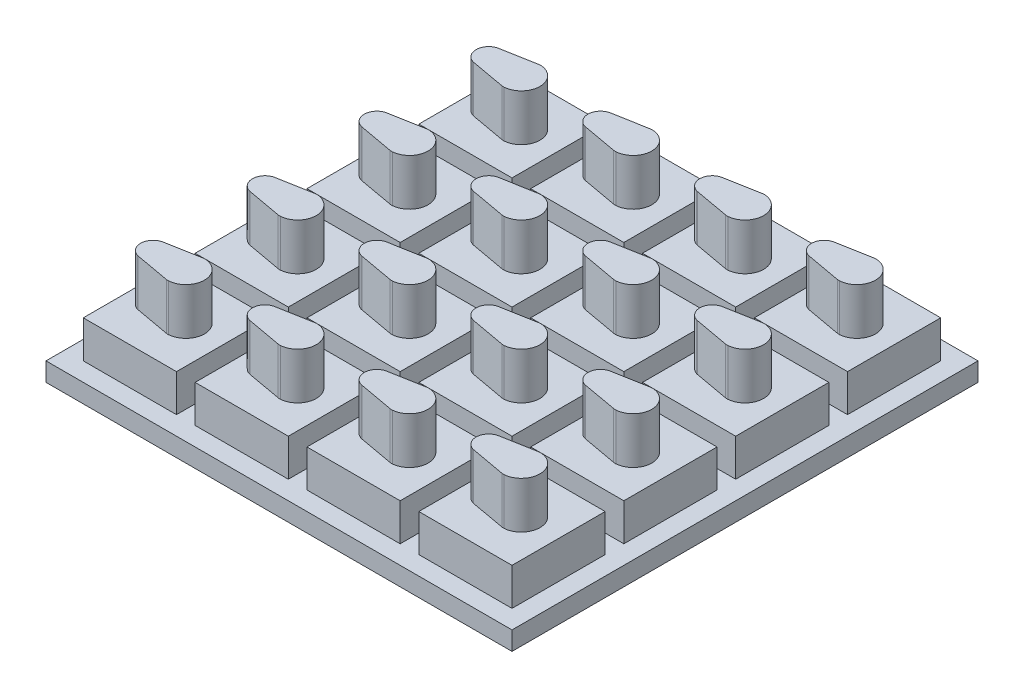
from build123d import *

# Parameters (mm, degrees)
BOSS_EXTRUDE10_DEPTH    = 11
BOSS_EXTRUDE10_2_DEPTH  = 11
BOSS_EXTRUDE10_3_DEPTH  = 11
BOSS_EXTRUDE10_4_DEPTH  = 11
BOSS_EXTRUDE10_5_DEPTH  = 11
BOSS_EXTRUDE10_6_DEPTH  = 11
BOSS_EXTRUDE10_7_DEPTH  = 11
BOSS_EXTRUDE10_8_DEPTH  = 11
BOSS_EXTRUDE10_9_DEPTH  = 11
BOSS_EXTRUDE10_10_DEPTH = 11
BOSS_EXTRUDE10_11_DEPTH = 11
BOSS_EXTRUDE10_12_DEPTH = 11
BOSS_EXTRUDE10_13_DEPTH = 11
BOSS_EXTRUDE10_14_DEPTH = 11
BOSS_EXTRUDE10_15_DEPTH = 11
BOSS_EXTRUDE10_16_DEPTH = 11
SKETCH1_21_W            = 10
SKETCH1_21_H            = 10
BOSS_EXTRUDE11_DEPTH    = 6
SKETCH1_22_W            = 10
SKETCH1_22_H            = 10
BOSS_EXTRUDE12_DEPTH    = 2


with BuildPart() as part:
    # Sketch1 → Boss-Extrude10 (new body)
    with BuildSketch(Plane(origin=(0, 0, 0), x_dir=(1, 0, 0), z_dir=(0, 1, 0))):
        with BuildLine():
            Line((-0.103477426, 1.981305986), (-3.791774707, 1.314985976))
            ThreePointArc((-3.791774707, 1.314985976), (-3.866472803, 1.298518324), (-3.939693652, 1.27638924))
            ThreePointArc((-3.939693652, 1.27638924), (-4.85, 0), (-3.939693652, -1.27638924))
            ThreePointArc((-3.939693652, -1.27638924), (-3.866472803, -1.298518324), (-3.791774707, -1.314985976))
            Line((-3.791774707, -1.314985976), (-0.103477426, -1.981305986))
            ThreePointArc((-0.103477426, -1.981305986), (0.022146835, -1.995874699), (0.14860526, -1.994471478))
            ThreePointArc((0.14860526, -1.994471478), (2, 0), (0.14860526, 1.994471478))
            ThreePointArc((0.14860526, 1.994471478), (0.022146835, 1.995874699), (-0.103477426, 1.981305986))
        make_face()
    extrude(amount=BOSS_EXTRUDE10_DEPTH)



with BuildPart() as body_2:
    # Sketch1 → Boss-Extrude10 2 (new body)
    with BuildSketch(Plane(origin=(0, 0, 0), x_dir=(1, 0, 0), z_dir=(0, 1, 0))):
        with BuildLine():
            Line((-12.103477426, 1.981305986), (-15.791774707, 1.314985976))
            ThreePointArc((-15.791774707, 1.314985976), (-15.866472803, 1.298518324), (-15.939693652, 1.27638924))
            ThreePointArc((-15.939693652, 1.27638924), (-16.85, 0), (-15.939693652, -1.27638924))
            ThreePointArc((-15.939693652, -1.27638924), (-15.866472803, -1.298518324), (-15.791774707, -1.314985976))
            Line((-15.791774707, -1.314985976), (-12.103477426, -1.981305986))
            ThreePointArc((-12.103477426, -1.981305986), (-11.977853165, -1.995874699), (-11.85139474, -1.994471478))
            ThreePointArc((-11.85139474, -1.994471478), (-10, 0), (-11.85139474, 1.994471478))
            ThreePointArc((-11.85139474, 1.994471478), (-11.977853165, 1.995874699), (-12.103477426, 1.981305986))
        make_face()
    extrude(amount=BOSS_EXTRUDE10_2_DEPTH)


with BuildPart() as body_3:
    # Sketch1 → Boss-Extrude10 3 (new body)
    with BuildSketch(Plane(origin=(0, 0, 0), x_dir=(1, 0, 0), z_dir=(0, 1, 0))):
        with BuildLine():
            Line((-24.103477426, 1.981305986), (-27.791774707, 1.314985976))
            ThreePointArc((-27.791774707, 1.314985976), (-27.866472803, 1.298518324), (-27.939693652, 1.27638924))
            ThreePointArc((-27.939693652, 1.27638924), (-28.85, 0), (-27.939693652, -1.27638924))
            ThreePointArc((-27.939693652, -1.27638924), (-27.866472803, -1.298518324), (-27.791774707, -1.314985976))
            Line((-27.791774707, -1.314985976), (-24.103477426, -1.981305986))
            ThreePointArc((-24.103477426, -1.981305986), (-23.977853165, -1.995874699), (-23.85139474, -1.994471478))
            ThreePointArc((-23.85139474, -1.994471478), (-22, 0), (-23.85139474, 1.994471478))
            ThreePointArc((-23.85139474, 1.994471478), (-23.977853165, 1.995874699), (-24.103477426, 1.981305986))
        make_face()
    extrude(amount=BOSS_EXTRUDE10_3_DEPTH)


with BuildPart() as body_4:
    # Sketch1 → Boss-Extrude10 4 (new body)
    with BuildSketch(Plane(origin=(0, 0, 0), x_dir=(1, 0, 0), z_dir=(0, 1, 0))):
        with BuildLine():
            Line((-0.103477426, 13.981305986), (-3.791774707, 13.314985976))
            ThreePointArc((-3.791774707, 13.314985976), (-3.866472803, 13.298518324), (-3.939693652, 13.27638924))
            ThreePointArc((-3.939693652, 13.27638924), (-4.85, 12), (-3.939693652, 10.72361076))
            ThreePointArc((-3.939693652, 10.72361076), (-3.866472803, 10.701481676), (-3.791774707, 10.685014024))
            Line((-3.791774707, 10.685014024), (-0.103477426, 10.018694014))
            ThreePointArc((-0.103477426, 10.018694014), (0.022146835, 10.004125301), (0.14860526, 10.005528522))
            ThreePointArc((0.14860526, 10.005528522), (2, 12), (0.14860526, 13.994471478))
            ThreePointArc((0.14860526, 13.994471478), (0.022146835, 13.995874699), (-0.103477426, 13.981305986))
        make_face()
    extrude(amount=BOSS_EXTRUDE10_4_DEPTH)


with BuildPart() as body_5:
    # Sketch1 → Boss-Extrude10 5 (new body)
    with BuildSketch(Plane(origin=(0, 0, 0), x_dir=(1, 0, 0), z_dir=(0, 1, 0))):
        with BuildLine():
            Line((-12.103477426, 13.981305986), (-15.791774707, 13.314985976))
            ThreePointArc((-15.791774707, 13.314985976), (-15.866472803, 13.298518324), (-15.939693652, 13.27638924))
            ThreePointArc((-15.939693652, 13.27638924), (-16.85, 12), (-15.939693652, 10.72361076))
            ThreePointArc((-15.939693652, 10.72361076), (-15.866472803, 10.701481676), (-15.791774707, 10.685014024))
            Line((-15.791774707, 10.685014024), (-12.103477426, 10.018694014))
            ThreePointArc((-12.103477426, 10.018694014), (-11.977853165, 10.004125301), (-11.85139474, 10.005528522))
            ThreePointArc((-11.85139474, 10.005528522), (-10, 12), (-11.85139474, 13.994471478))
            ThreePointArc((-11.85139474, 13.994471478), (-11.977853165, 13.995874699), (-12.103477426, 13.981305986))
        make_face()
    extrude(amount=BOSS_EXTRUDE10_5_DEPTH)


with BuildPart() as body_6:
    # Sketch1 → Boss-Extrude10 6 (new body)
    with BuildSketch(Plane(origin=(0, 0, 0), x_dir=(1, 0, 0), z_dir=(0, 1, 0))):
        with BuildLine():
            Line((-24.103477426, 13.981305986), (-27.791774707, 13.314985976))
            ThreePointArc((-27.791774707, 13.314985976), (-27.866472803, 13.298518324), (-27.939693652, 13.27638924))
            ThreePointArc((-27.939693652, 13.27638924), (-28.85, 12), (-27.939693652, 10.72361076))
            ThreePointArc((-27.939693652, 10.72361076), (-27.866472803, 10.701481676), (-27.791774707, 10.685014024))
            Line((-27.791774707, 10.685014024), (-24.103477426, 10.018694014))
            ThreePointArc((-24.103477426, 10.018694014), (-23.977853165, 10.004125301), (-23.85139474, 10.005528522))
            ThreePointArc((-23.85139474, 10.005528522), (-22, 12), (-23.85139474, 13.994471478))
            ThreePointArc((-23.85139474, 13.994471478), (-23.977853165, 13.995874699), (-24.103477426, 13.981305986))
        make_face()
    extrude(amount=BOSS_EXTRUDE10_6_DEPTH)


with BuildPart() as body_7:
    # Sketch1 → Boss-Extrude10 7 (new body)
    with BuildSketch(Plane(origin=(0, 0, 0), x_dir=(1, 0, 0), z_dir=(0, 1, 0))):
        with BuildLine():
            Line((-12.103477426, -10.018694014), (-15.791774707, -10.685014024))
            ThreePointArc((-15.791774707, -10.685014024), (-15.866472803, -10.701481676), (-15.939693652, -10.72361076))
            ThreePointArc((-15.939693652, -10.72361076), (-16.85, -12), (-15.939693652, -13.27638924))
            ThreePointArc((-15.939693652, -13.27638924), (-15.866472803, -13.298518324), (-15.791774707, -13.314985976))
            Line((-15.791774707, -13.314985976), (-12.103477426, -13.981305986))
            ThreePointArc((-12.103477426, -13.981305986), (-11.977853165, -13.995874699), (-11.85139474, -13.994471478))
            ThreePointArc((-11.85139474, -13.994471478), (-10, -12), (-11.85139474, -10.005528522))
            ThreePointArc((-11.85139474, -10.005528522), (-11.977853165, -10.004125301), (-12.103477426, -10.018694014))
        make_face()
    extrude(amount=BOSS_EXTRUDE10_7_DEPTH)


with BuildPart() as body_8:
    # Sketch1 → Boss-Extrude10 8 (new body)
    with BuildSketch(Plane(origin=(0, 0, 0), x_dir=(1, 0, 0), z_dir=(0, 1, 0))):
        with BuildLine():
            Line((-0.103477426, -10.018694014), (-3.791774707, -10.685014024))
            ThreePointArc((-3.791774707, -10.685014024), (-3.866472803, -10.701481676), (-3.939693652, -10.72361076))
            ThreePointArc((-3.939693652, -10.72361076), (-4.85, -12), (-3.939693652, -13.27638924))
            ThreePointArc((-3.939693652, -13.27638924), (-3.866472803, -13.298518324), (-3.791774707, -13.314985976))
            Line((-3.791774707, -13.314985976), (-0.103477426, -13.981305986))
            ThreePointArc((-0.103477426, -13.981305986), (0.022146835, -13.995874699), (0.14860526, -13.994471478))
            ThreePointArc((0.14860526, -13.994471478), (2, -12), (0.14860526, -10.005528522))
            ThreePointArc((0.14860526, -10.005528522), (0.022146835, -10.004125301), (-0.103477426, -10.018694014))
        make_face()
    extrude(amount=BOSS_EXTRUDE10_8_DEPTH)


with BuildPart() as body_9:
    # Sketch1 → Boss-Extrude10 9 (new body)
    with BuildSketch(Plane(origin=(0, 0, 0), x_dir=(1, 0, 0), z_dir=(0, 1, 0))):
        with BuildLine():
            Line((-24.103477426, -10.018694014), (-27.791774707, -10.685014024))
            ThreePointArc((-27.791774707, -10.685014024), (-27.866472803, -10.701481676), (-27.939693652, -10.72361076))
            ThreePointArc((-27.939693652, -10.72361076), (-28.85, -12), (-27.939693652, -13.27638924))
            ThreePointArc((-27.939693652, -13.27638924), (-27.866472803, -13.298518324), (-27.791774707, -13.314985976))
            Line((-27.791774707, -13.314985976), (-24.103477426, -13.981305986))
            ThreePointArc((-24.103477426, -13.981305986), (-23.977853165, -13.995874699), (-23.85139474, -13.994471478))
            ThreePointArc((-23.85139474, -13.994471478), (-22, -12), (-23.85139474, -10.005528522))
            ThreePointArc((-23.85139474, -10.005528522), (-23.977853165, -10.004125301), (-24.103477426, -10.018694014))
        make_face()
    extrude(amount=BOSS_EXTRUDE10_9_DEPTH)


with BuildPart() as body_10:
    # Sketch1 → Boss-Extrude10 10 (new body)
    with BuildSketch(Plane(origin=(0, 0, 0), x_dir=(1, 0, 0), z_dir=(0, 1, 0))):
        with BuildLine():
            Line((-0.103477426, 25.981305986), (-3.791774707, 25.314985976))
            ThreePointArc((-3.791774707, 25.314985976), (-3.866472803, 25.298518324), (-3.939693652, 25.27638924))
            ThreePointArc((-3.939693652, 25.27638924), (-4.85, 24), (-3.939693652, 22.72361076))
            ThreePointArc((-3.939693652, 22.72361076), (-3.866472803, 22.701481676), (-3.791774707, 22.685014024))
            Line((-3.791774707, 22.685014024), (-0.103477426, 22.018694014))
            ThreePointArc((-0.103477426, 22.018694014), (0.022146835, 22.004125301), (0.14860526, 22.005528522))
            ThreePointArc((0.14860526, 22.005528522), (2, 24), (0.14860526, 25.994471478))
            ThreePointArc((0.14860526, 25.994471478), (0.022146835, 25.995874699), (-0.103477426, 25.981305986))
        make_face()
    extrude(amount=BOSS_EXTRUDE10_10_DEPTH)


with BuildPart() as body_11:
    # Sketch1 → Boss-Extrude10 11 (new body)
    with BuildSketch(Plane(origin=(0, 0, 0), x_dir=(1, 0, 0), z_dir=(0, 1, 0))):
        with BuildLine():
            Line((-12.103477426, 25.981305986), (-15.791774707, 25.314985976))
            ThreePointArc((-15.791774707, 25.314985976), (-15.866472803, 25.298518324), (-15.939693652, 25.27638924))
            ThreePointArc((-15.939693652, 25.27638924), (-16.85, 24), (-15.939693652, 22.72361076))
            ThreePointArc((-15.939693652, 22.72361076), (-15.866472803, 22.701481676), (-15.791774707, 22.685014024))
            Line((-15.791774707, 22.685014024), (-12.103477426, 22.018694014))
            ThreePointArc((-12.103477426, 22.018694014), (-11.977853165, 22.004125301), (-11.85139474, 22.005528522))
            ThreePointArc((-11.85139474, 22.005528522), (-10, 24), (-11.85139474, 25.994471478))
            ThreePointArc((-11.85139474, 25.994471478), (-11.977853165, 25.995874699), (-12.103477426, 25.981305986))
        make_face()
    extrude(amount=BOSS_EXTRUDE10_11_DEPTH)


with BuildPart() as body_12:
    # Sketch1 → Boss-Extrude10 12 (new body)
    with BuildSketch(Plane(origin=(0, 0, 0), x_dir=(1, 0, 0), z_dir=(0, 1, 0))):
        with BuildLine():
            Line((-24.103477426, 25.981305986), (-27.791774707, 25.314985976))
            ThreePointArc((-27.791774707, 25.314985976), (-27.866472803, 25.298518324), (-27.939693652, 25.27638924))
            ThreePointArc((-27.939693652, 25.27638924), (-28.85, 24), (-27.939693652, 22.72361076))
            ThreePointArc((-27.939693652, 22.72361076), (-27.866472803, 22.701481676), (-27.791774707, 22.685014024))
            Line((-27.791774707, 22.685014024), (-24.103477426, 22.018694014))
            ThreePointArc((-24.103477426, 22.018694014), (-23.977853165, 22.004125301), (-23.85139474, 22.005528522))
            ThreePointArc((-23.85139474, 22.005528522), (-22, 24), (-23.85139474, 25.994471478))
            ThreePointArc((-23.85139474, 25.994471478), (-23.977853165, 25.995874699), (-24.103477426, 25.981305986))
        make_face()
    extrude(amount=BOSS_EXTRUDE10_12_DEPTH)


with BuildPart() as body_13:
    # Sketch1 → Boss-Extrude10 13 (new body)
    with BuildSketch(Plane(origin=(0, 0, 0), x_dir=(1, 0, 0), z_dir=(0, 1, 0))):
        with BuildLine():
            Line((-36.103477426, -10.018694014), (-39.791774707, -10.685014024))
            ThreePointArc((-39.791774707, -10.685014024), (-39.866472803, -10.701481676), (-39.939693652, -10.72361076))
            ThreePointArc((-39.939693652, -10.72361076), (-40.85, -12), (-39.939693652, -13.27638924))
            ThreePointArc((-39.939693652, -13.27638924), (-39.866472803, -13.298518324), (-39.791774707, -13.314985976))
            Line((-39.791774707, -13.314985976), (-36.103477426, -13.981305986))
            ThreePointArc((-36.103477426, -13.981305986), (-35.977853165, -13.995874699), (-35.85139474, -13.994471478))
            ThreePointArc((-35.85139474, -13.994471478), (-34, -12), (-35.85139474, -10.005528522))
            ThreePointArc((-35.85139474, -10.005528522), (-35.977853165, -10.004125301), (-36.103477426, -10.018694014))
        make_face()
    extrude(amount=BOSS_EXTRUDE10_13_DEPTH)


with BuildPart() as body_14:
    # Sketch1 → Boss-Extrude10 14 (new body)
    with BuildSketch(Plane(origin=(0, 0, 0), x_dir=(1, 0, 0), z_dir=(0, 1, 0))):
        with BuildLine():
            Line((-36.103477426, 25.981305986), (-39.791774707, 25.314985976))
            ThreePointArc((-39.791774707, 25.314985976), (-39.866472803, 25.298518324), (-39.939693652, 25.27638924))
            ThreePointArc((-39.939693652, 25.27638924), (-40.85, 24), (-39.939693652, 22.72361076))
            ThreePointArc((-39.939693652, 22.72361076), (-39.866472803, 22.701481676), (-39.791774707, 22.685014024))
            Line((-39.791774707, 22.685014024), (-36.103477426, 22.018694014))
            ThreePointArc((-36.103477426, 22.018694014), (-35.977853165, 22.004125301), (-35.85139474, 22.005528522))
            ThreePointArc((-35.85139474, 22.005528522), (-34, 24), (-35.85139474, 25.994471478))
            ThreePointArc((-35.85139474, 25.994471478), (-35.977853165, 25.995874699), (-36.103477426, 25.981305986))
        make_face()
    extrude(amount=BOSS_EXTRUDE10_14_DEPTH)


with BuildPart() as body_15:
    # Sketch1 → Boss-Extrude10 15 (new body)
    with BuildSketch(Plane(origin=(0, 0, 0), x_dir=(1, 0, 0), z_dir=(0, 1, 0))):
        with BuildLine():
            Line((-36.103477426, 1.981305986), (-39.791774707, 1.314985976))
            ThreePointArc((-39.791774707, 1.314985976), (-39.866472803, 1.298518324), (-39.939693652, 1.27638924))
            ThreePointArc((-39.939693652, 1.27638924), (-40.85, 0), (-39.939693652, -1.27638924))
            ThreePointArc((-39.939693652, -1.27638924), (-39.866472803, -1.298518324), (-39.791774707, -1.314985976))
            Line((-39.791774707, -1.314985976), (-36.103477426, -1.981305986))
            ThreePointArc((-36.103477426, -1.981305986), (-35.977853165, -1.995874699), (-35.85139474, -1.994471478))
            ThreePointArc((-35.85139474, -1.994471478), (-34, 0), (-35.85139474, 1.994471478))
            ThreePointArc((-35.85139474, 1.994471478), (-35.977853165, 1.995874699), (-36.103477426, 1.981305986))
        make_face()
    extrude(amount=BOSS_EXTRUDE10_15_DEPTH)


with BuildPart() as body_16:
    # Sketch1 → Boss-Extrude10 16 (new body)
    with BuildSketch(Plane(origin=(0, 0, 0), x_dir=(1, 0, 0), z_dir=(0, 1, 0))):
        with BuildLine():
            Line((-36.103477426, 13.981305986), (-39.791774707, 13.314985976))
            ThreePointArc((-39.791774707, 13.314985976), (-39.866472803, 13.298518324), (-39.939693652, 13.27638924))
            ThreePointArc((-39.939693652, 13.27638924), (-40.85, 12), (-39.939693652, 10.72361076))
            ThreePointArc((-39.939693652, 10.72361076), (-39.866472803, 10.701481676), (-39.791774707, 10.685014024))
            Line((-39.791774707, 10.685014024), (-36.103477426, 10.018694014))
            ThreePointArc((-36.103477426, 10.018694014), (-35.977853165, 10.004125301), (-35.85139474, 10.005528522))
            ThreePointArc((-35.85139474, 10.005528522), (-34, 12), (-35.85139474, 13.994471478))
            ThreePointArc((-35.85139474, 13.994471478), (-35.977853165, 13.995874699), (-36.103477426, 13.981305986))
        make_face()
    extrude(amount=BOSS_EXTRUDE10_16_DEPTH)


with BuildPart() as part_1:
    add(part.part)

    add(body_2.part)  # Boss-Extrude11 merges body 2

    add(body_3.part)  # Boss-Extrude11 merges body 3

    add(body_4.part)  # Boss-Extrude11 merges body 4

    add(body_5.part)  # Boss-Extrude11 merges body 5

    add(body_6.part)  # Boss-Extrude11 merges body 6

    add(body_7.part)  # Boss-Extrude11 merges body 7

    add(body_8.part)  # Boss-Extrude11 merges body 8

    add(body_9.part)  # Boss-Extrude11 merges body 9

    add(body_10.part)  # Boss-Extrude11 merges body 10

    add(body_11.part)  # Boss-Extrude11 merges body 11

    add(body_12.part)  # Boss-Extrude11 merges body 12

    add(body_13.part)  # Boss-Extrude11 merges body 13

    add(body_14.part)  # Boss-Extrude11 merges body 14

    add(body_15.part)  # Boss-Extrude11 merges body 15

    add(body_16.part)  # Boss-Extrude11 merges body 16
    # Sketch1<21> → Boss-Extrude11 (add)
    # profile 1 of 16: a face of its own
    with BuildSketch(Plane(origin=(0, 0, 0), x_dir=(1, 0, 0), z_dir=(0, 1, 0))):
        with Locations((-37, 24)):
            Rectangle(SKETCH1_21_W, SKETCH1_21_H)
        with BuildLine():
            Line((-39.791774707, 25.314985976), (-36.103477426, 25.981305986))
            ThreePointArc((-36.103477426, 25.981305986), (-35.977853165, 25.995874699), (-35.85139474, 25.994471478))
            ThreePointArc((-35.85139474, 25.994471478), (-34, 24), (-35.85139474, 22.005528522))
            ThreePointArc((-35.85139474, 22.005528522), (-35.977853165, 22.004125301), (-36.103477426, 22.018694014))
            Line((-36.103477426, 22.018694014), (-39.791774707, 22.685014024))
            ThreePointArc((-39.791774707, 22.685014024), (-39.866472803, 22.701481676), (-39.939693652, 22.72361076))
            ThreePointArc((-39.939693652, 22.72361076), (-40.85, 24), (-39.939693652, 25.27638924))
            ThreePointArc((-39.939693652, 25.27638924), (-39.866472803, 25.298518324), (-39.791774707, 25.314985976))
        make_face(mode=Mode.SUBTRACT)
    # profile 2 of 16: a face of its own
    with BuildSketch(Plane(origin=(0, 0, 0), x_dir=(1, 0, 0), z_dir=(0, 1, 0))):
        with Locations((-25, 24)):
            Rectangle(SKETCH1_21_W, SKETCH1_21_H)
        with BuildLine():
            Line((-27.791774707, 25.314985976), (-24.103477426, 25.981305986))
            ThreePointArc((-24.103477426, 25.981305986), (-23.977853165, 25.995874699), (-23.85139474, 25.994471478))
            ThreePointArc((-23.85139474, 25.994471478), (-22, 24), (-23.85139474, 22.005528522))
            ThreePointArc((-23.85139474, 22.005528522), (-23.977853165, 22.004125301), (-24.103477426, 22.018694014))
            Line((-24.103477426, 22.018694014), (-27.791774707, 22.685014024))
            ThreePointArc((-27.791774707, 22.685014024), (-27.866472803, 22.701481676), (-27.939693652, 22.72361076))
            ThreePointArc((-27.939693652, 22.72361076), (-28.85, 24), (-27.939693652, 25.27638924))
            ThreePointArc((-27.939693652, 25.27638924), (-27.866472803, 25.298518324), (-27.791774707, 25.314985976))
        make_face(mode=Mode.SUBTRACT)
    # profile 3 of 16: a face of its own
    with BuildSketch(Plane(origin=(0, 0, 0), x_dir=(1, 0, 0), z_dir=(0, 1, 0))):
        with Locations((-13, 24)):
            Rectangle(SKETCH1_21_W, SKETCH1_21_H)
        with BuildLine():
            Line((-15.791774707, 25.314985976), (-12.103477426, 25.981305986))
            ThreePointArc((-12.103477426, 25.981305986), (-11.977853165, 25.995874699), (-11.85139474, 25.994471478))
            ThreePointArc((-11.85139474, 25.994471478), (-10, 24), (-11.85139474, 22.005528522))
            ThreePointArc((-11.85139474, 22.005528522), (-11.977853165, 22.004125301), (-12.103477426, 22.018694014))
            Line((-12.103477426, 22.018694014), (-15.791774707, 22.685014024))
            ThreePointArc((-15.791774707, 22.685014024), (-15.866472803, 22.701481676), (-15.939693652, 22.72361076))
            ThreePointArc((-15.939693652, 22.72361076), (-16.85, 24), (-15.939693652, 25.27638924))
            ThreePointArc((-15.939693652, 25.27638924), (-15.866472803, 25.298518324), (-15.791774707, 25.314985976))
        make_face(mode=Mode.SUBTRACT)
    # profile 4 of 16: a face of its own
    with BuildSketch(Plane(origin=(0, 0, 0), x_dir=(1, 0, 0), z_dir=(0, 1, 0))):
        with Locations((-1, 24)):
            Rectangle(SKETCH1_21_W, SKETCH1_21_H)
        with BuildLine():
            Line((-3.791774707, 25.314985976), (-0.103477426, 25.981305986))
            ThreePointArc((-0.103477426, 25.981305986), (0.022146835, 25.995874699), (0.14860526, 25.994471478))
            ThreePointArc((0.14860526, 25.994471478), (2, 24), (0.14860526, 22.005528522))
            ThreePointArc((0.14860526, 22.005528522), (0.022146835, 22.004125301), (-0.103477426, 22.018694014))
            Line((-0.103477426, 22.018694014), (-3.791774707, 22.685014024))
            ThreePointArc((-3.791774707, 22.685014024), (-3.866472803, 22.701481676), (-3.939693652, 22.72361076))
            ThreePointArc((-3.939693652, 22.72361076), (-4.85, 24), (-3.939693652, 25.27638924))
            ThreePointArc((-3.939693652, 25.27638924), (-3.866472803, 25.298518324), (-3.791774707, 25.314985976))
        make_face(mode=Mode.SUBTRACT)
    # profile 5 of 16: a face of its own
    with BuildSketch(Plane(origin=(0, 0, 0), x_dir=(1, 0, 0), z_dir=(0, 1, 0))):
        with Locations((-37, 12)):
            Rectangle(SKETCH1_21_W, SKETCH1_21_H)
        with BuildLine():
            Line((-39.791774707, 13.314985976), (-36.103477426, 13.981305986))
            ThreePointArc((-36.103477426, 13.981305986), (-35.977853165, 13.995874699), (-35.85139474, 13.994471478))
            ThreePointArc((-35.85139474, 13.994471478), (-34, 12), (-35.85139474, 10.005528522))
            ThreePointArc((-35.85139474, 10.005528522), (-35.977853165, 10.004125301), (-36.103477426, 10.018694014))
            Line((-36.103477426, 10.018694014), (-39.791774707, 10.685014024))
            ThreePointArc((-39.791774707, 10.685014024), (-39.866472803, 10.701481676), (-39.939693652, 10.72361076))
            ThreePointArc((-39.939693652, 10.72361076), (-40.85, 12), (-39.939693652, 13.27638924))
            ThreePointArc((-39.939693652, 13.27638924), (-39.866472803, 13.298518324), (-39.791774707, 13.314985976))
        make_face(mode=Mode.SUBTRACT)
    # profile 6 of 16: a face of its own
    with BuildSketch(Plane(origin=(0, 0, 0), x_dir=(1, 0, 0), z_dir=(0, 1, 0))):
        with Locations((-25, 12)):
            Rectangle(SKETCH1_21_W, SKETCH1_21_H)
        with BuildLine():
            Line((-27.791774707, 13.314985976), (-24.103477426, 13.981305986))
            ThreePointArc((-24.103477426, 13.981305986), (-23.977853165, 13.995874699), (-23.85139474, 13.994471478))
            ThreePointArc((-23.85139474, 13.994471478), (-22, 12), (-23.85139474, 10.005528522))
            ThreePointArc((-23.85139474, 10.005528522), (-23.977853165, 10.004125301), (-24.103477426, 10.018694014))
            Line((-24.103477426, 10.018694014), (-27.791774707, 10.685014024))
            ThreePointArc((-27.791774707, 10.685014024), (-27.866472803, 10.701481676), (-27.939693652, 10.72361076))
            ThreePointArc((-27.939693652, 10.72361076), (-28.85, 12), (-27.939693652, 13.27638924))
            ThreePointArc((-27.939693652, 13.27638924), (-27.866472803, 13.298518324), (-27.791774707, 13.314985976))
        make_face(mode=Mode.SUBTRACT)
    # profile 7 of 16: a face of its own
    with BuildSketch(Plane(origin=(0, 0, 0), x_dir=(1, 0, 0), z_dir=(0, 1, 0))):
        with Locations((-13, 12)):
            Rectangle(SKETCH1_21_W, SKETCH1_21_H)
        with BuildLine():
            Line((-15.791774707, 13.314985976), (-12.103477426, 13.981305986))
            ThreePointArc((-12.103477426, 13.981305986), (-11.977853165, 13.995874699), (-11.85139474, 13.994471478))
            ThreePointArc((-11.85139474, 13.994471478), (-10, 12), (-11.85139474, 10.005528522))
            ThreePointArc((-11.85139474, 10.005528522), (-11.977853165, 10.004125301), (-12.103477426, 10.018694014))
            Line((-12.103477426, 10.018694014), (-15.791774707, 10.685014024))
            ThreePointArc((-15.791774707, 10.685014024), (-15.866472803, 10.701481676), (-15.939693652, 10.72361076))
            ThreePointArc((-15.939693652, 10.72361076), (-16.85, 12), (-15.939693652, 13.27638924))
            ThreePointArc((-15.939693652, 13.27638924), (-15.866472803, 13.298518324), (-15.791774707, 13.314985976))
        make_face(mode=Mode.SUBTRACT)
    # profile 8 of 16: a face of its own
    with BuildSketch(Plane(origin=(0, 0, 0), x_dir=(1, 0, 0), z_dir=(0, 1, 0))):
        with Locations((-1, 12)):
            Rectangle(SKETCH1_21_W, SKETCH1_21_H)
        with BuildLine():
            Line((-3.791774707, 13.314985976), (-0.103477426, 13.981305986))
            ThreePointArc((-0.103477426, 13.981305986), (0.022146835, 13.995874699), (0.14860526, 13.994471478))
            ThreePointArc((0.14860526, 13.994471478), (2, 12), (0.14860526, 10.005528522))
            ThreePointArc((0.14860526, 10.005528522), (0.022146835, 10.004125301), (-0.103477426, 10.018694014))
            Line((-0.103477426, 10.018694014), (-3.791774707, 10.685014024))
            ThreePointArc((-3.791774707, 10.685014024), (-3.866472803, 10.701481676), (-3.939693652, 10.72361076))
            ThreePointArc((-3.939693652, 10.72361076), (-4.85, 12), (-3.939693652, 13.27638924))
            ThreePointArc((-3.939693652, 13.27638924), (-3.866472803, 13.298518324), (-3.791774707, 13.314985976))
        make_face(mode=Mode.SUBTRACT)
    # profile 9 of 16: a face of its own
    with BuildSketch(Plane(origin=(0, 0, 0), x_dir=(1, 0, 0), z_dir=(0, 1, 0))):
        with Locations((-1, 0)):
            Rectangle(SKETCH1_21_W, SKETCH1_21_H)
        with BuildLine():
            Line((-3.791774707, 1.314985976), (-0.103477426, 1.981305986))
            ThreePointArc((-0.103477426, 1.981305986), (0.022146835, 1.995874699), (0.14860526, 1.994471478))
            ThreePointArc((0.14860526, 1.994471478), (2, 0), (0.14860526, -1.994471478))
            ThreePointArc((0.14860526, -1.994471478), (0.022146835, -1.995874699), (-0.103477426, -1.981305986))
            Line((-0.103477426, -1.981305986), (-3.791774707, -1.314985976))
            ThreePointArc((-3.791774707, -1.314985976), (-3.866472803, -1.298518324), (-3.939693652, -1.27638924))
            ThreePointArc((-3.939693652, -1.27638924), (-4.85, 0), (-3.939693652, 1.27638924))
            ThreePointArc((-3.939693652, 1.27638924), (-3.866472803, 1.298518324), (-3.791774707, 1.314985976))
        make_face(mode=Mode.SUBTRACT)
    # profile 10 of 16: a face of its own
    with BuildSketch(Plane(origin=(0, 0, 0), x_dir=(1, 0, 0), z_dir=(0, 1, 0))):
        with Locations((-13, 0)):
            Rectangle(SKETCH1_21_W, SKETCH1_21_H)
        with BuildLine():
            Line((-15.791774707, 1.314985976), (-12.103477426, 1.981305986))
            ThreePointArc((-12.103477426, 1.981305986), (-11.977853165, 1.995874699), (-11.85139474, 1.994471478))
            ThreePointArc((-11.85139474, 1.994471478), (-10, 0), (-11.85139474, -1.994471478))
            ThreePointArc((-11.85139474, -1.994471478), (-11.977853165, -1.995874699), (-12.103477426, -1.981305986))
            Line((-12.103477426, -1.981305986), (-15.791774707, -1.314985976))
            ThreePointArc((-15.791774707, -1.314985976), (-15.866472803, -1.298518324), (-15.939693652, -1.27638924))
            ThreePointArc((-15.939693652, -1.27638924), (-16.85, 0), (-15.939693652, 1.27638924))
            ThreePointArc((-15.939693652, 1.27638924), (-15.866472803, 1.298518324), (-15.791774707, 1.314985976))
        make_face(mode=Mode.SUBTRACT)
    # profile 11 of 16: a face of its own
    with BuildSketch(Plane(origin=(0, 0, 0), x_dir=(1, 0, 0), z_dir=(0, 1, 0))):
        with Locations((-25, 0)):
            Rectangle(SKETCH1_21_W, SKETCH1_21_H)
        with BuildLine():
            Line((-27.791774707, 1.314985976), (-24.103477426, 1.981305986))
            ThreePointArc((-24.103477426, 1.981305986), (-23.977853165, 1.995874699), (-23.85139474, 1.994471478))
            ThreePointArc((-23.85139474, 1.994471478), (-22, 0), (-23.85139474, -1.994471478))
            ThreePointArc((-23.85139474, -1.994471478), (-23.977853165, -1.995874699), (-24.103477426, -1.981305986))
            Line((-24.103477426, -1.981305986), (-27.791774707, -1.314985976))
            ThreePointArc((-27.791774707, -1.314985976), (-27.866472803, -1.298518324), (-27.939693652, -1.27638924))
            ThreePointArc((-27.939693652, -1.27638924), (-28.85, 0), (-27.939693652, 1.27638924))
            ThreePointArc((-27.939693652, 1.27638924), (-27.866472803, 1.298518324), (-27.791774707, 1.314985976))
        make_face(mode=Mode.SUBTRACT)
    # profile 12 of 16: a face of its own
    with BuildSketch(Plane(origin=(0, 0, 0), x_dir=(1, 0, 0), z_dir=(0, 1, 0))):
        with Locations((-37, 0)):
            Rectangle(SKETCH1_21_W, SKETCH1_21_H)
        with BuildLine():
            Line((-39.791774707, 1.314985976), (-36.103477426, 1.981305986))
            ThreePointArc((-36.103477426, 1.981305986), (-35.977853165, 1.995874699), (-35.85139474, 1.994471478))
            ThreePointArc((-35.85139474, 1.994471478), (-34, 0), (-35.85139474, -1.994471478))
            ThreePointArc((-35.85139474, -1.994471478), (-35.977853165, -1.995874699), (-36.103477426, -1.981305986))
            Line((-36.103477426, -1.981305986), (-39.791774707, -1.314985976))
            ThreePointArc((-39.791774707, -1.314985976), (-39.866472803, -1.298518324), (-39.939693652, -1.27638924))
            ThreePointArc((-39.939693652, -1.27638924), (-40.85, 0), (-39.939693652, 1.27638924))
            ThreePointArc((-39.939693652, 1.27638924), (-39.866472803, 1.298518324), (-39.791774707, 1.314985976))
        make_face(mode=Mode.SUBTRACT)
    # profile 13 of 16: a face of its own
    with BuildSketch(Plane(origin=(0, 0, 0), x_dir=(1, 0, 0), z_dir=(0, 1, 0))):
        with Locations((-37, -12)):
            Rectangle(SKETCH1_21_W, SKETCH1_21_H)
        with BuildLine():
            Line((-39.791774707, -10.685014024), (-36.103477426, -10.018694014))
            ThreePointArc((-36.103477426, -10.018694014), (-35.977853165, -10.004125301), (-35.85139474, -10.005528522))
            ThreePointArc((-35.85139474, -10.005528522), (-34, -12), (-35.85139474, -13.994471478))
            ThreePointArc((-35.85139474, -13.994471478), (-35.977853165, -13.995874699), (-36.103477426, -13.981305986))
            Line((-36.103477426, -13.981305986), (-39.791774707, -13.314985976))
            ThreePointArc((-39.791774707, -13.314985976), (-39.866472803, -13.298518324), (-39.939693652, -13.27638924))
            ThreePointArc((-39.939693652, -13.27638924), (-40.85, -12), (-39.939693652, -10.72361076))
            ThreePointArc((-39.939693652, -10.72361076), (-39.866472803, -10.701481676), (-39.791774707, -10.685014024))
        make_face(mode=Mode.SUBTRACT)
    # profile 14 of 16: a face of its own
    with BuildSketch(Plane(origin=(0, 0, 0), x_dir=(1, 0, 0), z_dir=(0, 1, 0))):
        with Locations((-25, -12)):
            Rectangle(SKETCH1_21_W, SKETCH1_21_H)
        with BuildLine():
            Line((-27.791774707, -10.685014024), (-24.103477426, -10.018694014))
            ThreePointArc((-24.103477426, -10.018694014), (-23.977853165, -10.004125301), (-23.85139474, -10.005528522))
            ThreePointArc((-23.85139474, -10.005528522), (-22, -12), (-23.85139474, -13.994471478))
            ThreePointArc((-23.85139474, -13.994471478), (-23.977853165, -13.995874699), (-24.103477426, -13.981305986))
            Line((-24.103477426, -13.981305986), (-27.791774707, -13.314985976))
            ThreePointArc((-27.791774707, -13.314985976), (-27.866472803, -13.298518324), (-27.939693652, -13.27638924))
            ThreePointArc((-27.939693652, -13.27638924), (-28.85, -12), (-27.939693652, -10.72361076))
            ThreePointArc((-27.939693652, -10.72361076), (-27.866472803, -10.701481676), (-27.791774707, -10.685014024))
        make_face(mode=Mode.SUBTRACT)
    # profile 15 of 16: a face of its own
    with BuildSketch(Plane(origin=(0, 0, 0), x_dir=(1, 0, 0), z_dir=(0, 1, 0))):
        with Locations((-13, -12)):
            Rectangle(SKETCH1_21_W, SKETCH1_21_H)
        with BuildLine():
            Line((-15.791774707, -10.685014024), (-12.103477426, -10.018694014))
            ThreePointArc((-12.103477426, -10.018694014), (-11.977853165, -10.004125301), (-11.85139474, -10.005528522))
            ThreePointArc((-11.85139474, -10.005528522), (-10, -12), (-11.85139474, -13.994471478))
            ThreePointArc((-11.85139474, -13.994471478), (-11.977853165, -13.995874699), (-12.103477426, -13.981305986))
            Line((-12.103477426, -13.981305986), (-15.791774707, -13.314985976))
            ThreePointArc((-15.791774707, -13.314985976), (-15.866472803, -13.298518324), (-15.939693652, -13.27638924))
            ThreePointArc((-15.939693652, -13.27638924), (-16.85, -12), (-15.939693652, -10.72361076))
            ThreePointArc((-15.939693652, -10.72361076), (-15.866472803, -10.701481676), (-15.791774707, -10.685014024))
        make_face(mode=Mode.SUBTRACT)
    # profile 16 of 16: a face of its own
    with BuildSketch(Plane(origin=(0, 0, 0), x_dir=(1, 0, 0), z_dir=(0, 1, 0))):
        with Locations((-1, -12)):
            Rectangle(SKETCH1_21_W, SKETCH1_21_H)
        with BuildLine():
            Line((-3.791774707, -10.685014024), (-0.103477426, -10.018694014))
            ThreePointArc((-0.103477426, -10.018694014), (0.022146835, -10.004125301), (0.14860526, -10.005528522))
            ThreePointArc((0.14860526, -10.005528522), (2, -12), (0.14860526, -13.994471478))
            ThreePointArc((0.14860526, -13.994471478), (0.022146835, -13.995874699), (-0.103477426, -13.981305986))
            Line((-0.103477426, -13.981305986), (-3.791774707, -13.314985976))
            ThreePointArc((-3.791774707, -13.314985976), (-3.866472803, -13.298518324), (-3.939693652, -13.27638924))
            ThreePointArc((-3.939693652, -13.27638924), (-4.85, -12), (-3.939693652, -10.72361076))
            ThreePointArc((-3.939693652, -10.72361076), (-3.866472803, -10.701481676), (-3.791774707, -10.685014024))
        make_face(mode=Mode.SUBTRACT)
    extrude(amount=BOSS_EXTRUDE11_DEPTH)

    # Sketch1<22> → Boss-Extrude12 (add)
    with BuildSketch(Plane(origin=(0, 0, 0), x_dir=(1, 0, 0), z_dir=(0, 1, 0))):
        Polygon((4, 31), (-42, 31), (-44, 31), (-44, 29), (-44, -17), (-44, -19), (-42, -19), (4, -19), (6, -19), (6, -17), (6, 29), (6, 31), align=None)
        with Locations((-37, -12)):
            Rectangle(SKETCH1_22_W, SKETCH1_22_H, mode=Mode.SUBTRACT)
        with Locations((-25, -12)):
            Rectangle(SKETCH1_22_W, SKETCH1_22_H, mode=Mode.SUBTRACT)
        with Locations((-37, 0)):
            Rectangle(SKETCH1_22_W, SKETCH1_22_H, mode=Mode.SUBTRACT)
        with Locations((-25, 0)):
            Rectangle(SKETCH1_22_W, SKETCH1_22_H, mode=Mode.SUBTRACT)
        with Locations((-13, -12)):
            Rectangle(SKETCH1_22_W, SKETCH1_22_H, mode=Mode.SUBTRACT)
        with Locations((-1, -12)):
            Rectangle(SKETCH1_22_W, SKETCH1_22_H, mode=Mode.SUBTRACT)
        with Locations((-13, 0)):
            Rectangle(SKETCH1_22_W, SKETCH1_22_H, mode=Mode.SUBTRACT)
        with Locations((-1, 0)):
            Rectangle(SKETCH1_22_W, SKETCH1_22_H, mode=Mode.SUBTRACT)
        with Locations((-37, 12)):
            Rectangle(SKETCH1_22_W, SKETCH1_22_H, mode=Mode.SUBTRACT)
        with Locations((-25, 12)):
            Rectangle(SKETCH1_22_W, SKETCH1_22_H, mode=Mode.SUBTRACT)
        with Locations((-37, 24)):
            Rectangle(SKETCH1_22_W, SKETCH1_22_H, mode=Mode.SUBTRACT)
        with Locations((-25, 24)):
            Rectangle(SKETCH1_22_W, SKETCH1_22_H, mode=Mode.SUBTRACT)
        with Locations((-13, 12)):
            Rectangle(SKETCH1_22_W, SKETCH1_22_H, mode=Mode.SUBTRACT)
        with Locations((-1, 12)):
            Rectangle(SKETCH1_22_W, SKETCH1_22_H, mode=Mode.SUBTRACT)
        with Locations((-13, 24)):
            Rectangle(SKETCH1_22_W, SKETCH1_22_H, mode=Mode.SUBTRACT)
        with Locations((-1, 24)):
            Rectangle(SKETCH1_22_W, SKETCH1_22_H, mode=Mode.SUBTRACT)
    extrude(amount=BOSS_EXTRUDE12_DEPTH)


solid = part_1.part
